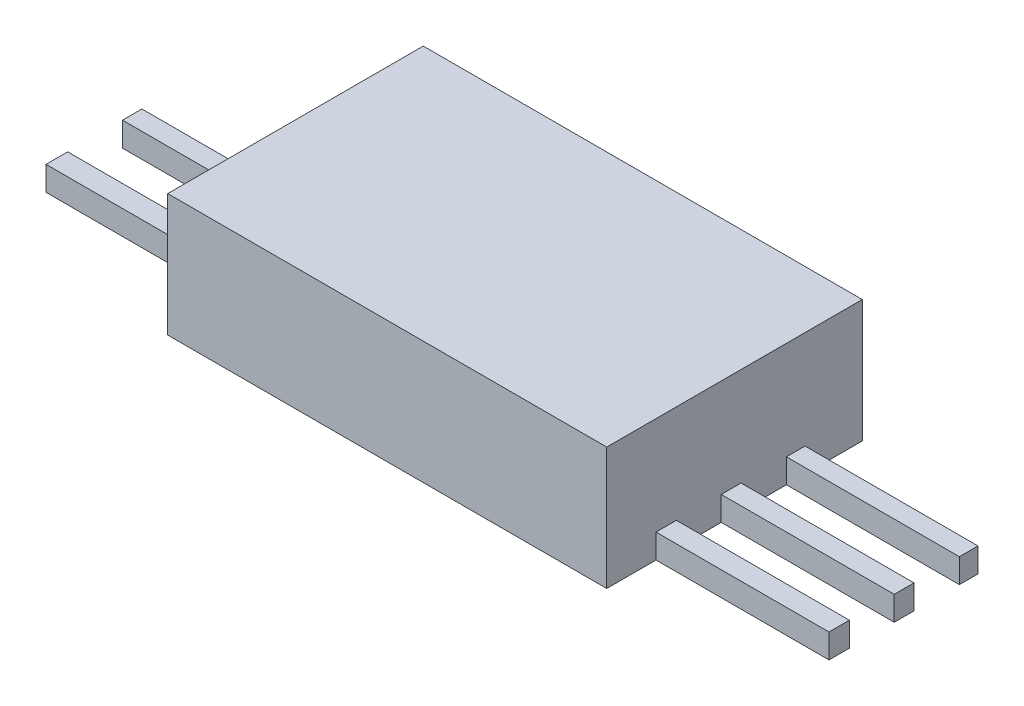
from build123d import *

# Parameters (mm, degrees)
SKETCH1_W           = 67
SKETCH1_H           = 39
BOSS_EXTRUDE1_DEPTH = 18.7
SKETCH2_W           = 28.153869909
SKETCH2_H           = 3.308256434
SKETCH2_H_2         = 2.957380752
SKETCH2_W_2         = 26.399491497
SKETCH2_H_3         = 3.107756044
SKETCH2_H_4         = 3.018867182
SKETCH2_H_5         = 2.841286759
BOSS_EXTRUDE2_DEPTH = 3.7


with BuildPart() as part:
    # Sketch1 → Boss-Extrude1 (new body)
    with BuildSketch(Plane(origin=(0, 0, 0), x_dir=(1, 0, 0), z_dir=(0, 1, 0))):
        with Locations((33.5, 19.5)):
            Rectangle(SKETCH1_W, SKETCH1_H)
    extrude(amount=BOSS_EXTRUDE1_DEPTH)

    # Sketch2 → Boss-Extrude2 (add)
    with BuildSketch(Plane.XZ):
        with Locations((-14.076934955, -11.229358915)):
            Rectangle(SKETCH2_W, SKETCH2_H)
        with Locations((-14.076934955, -22.733068788)):
            Rectangle(SKETCH2_W, SKETCH2_H_2)
        with Locations((80.199745748, -9.073979723)):
            Rectangle(SKETCH2_W_2, SKETCH2_H_3)
        with Locations((80.199745748, -18.984327025)):
            Rectangle(SKETCH2_W_2, SKETCH2_H_4)
        with Locations((80.199745748, -28.84004047)):
            Rectangle(SKETCH2_W_2, SKETCH2_H_5)
    extrude(amount=-BOSS_EXTRUDE2_DEPTH)


solid = part.part
